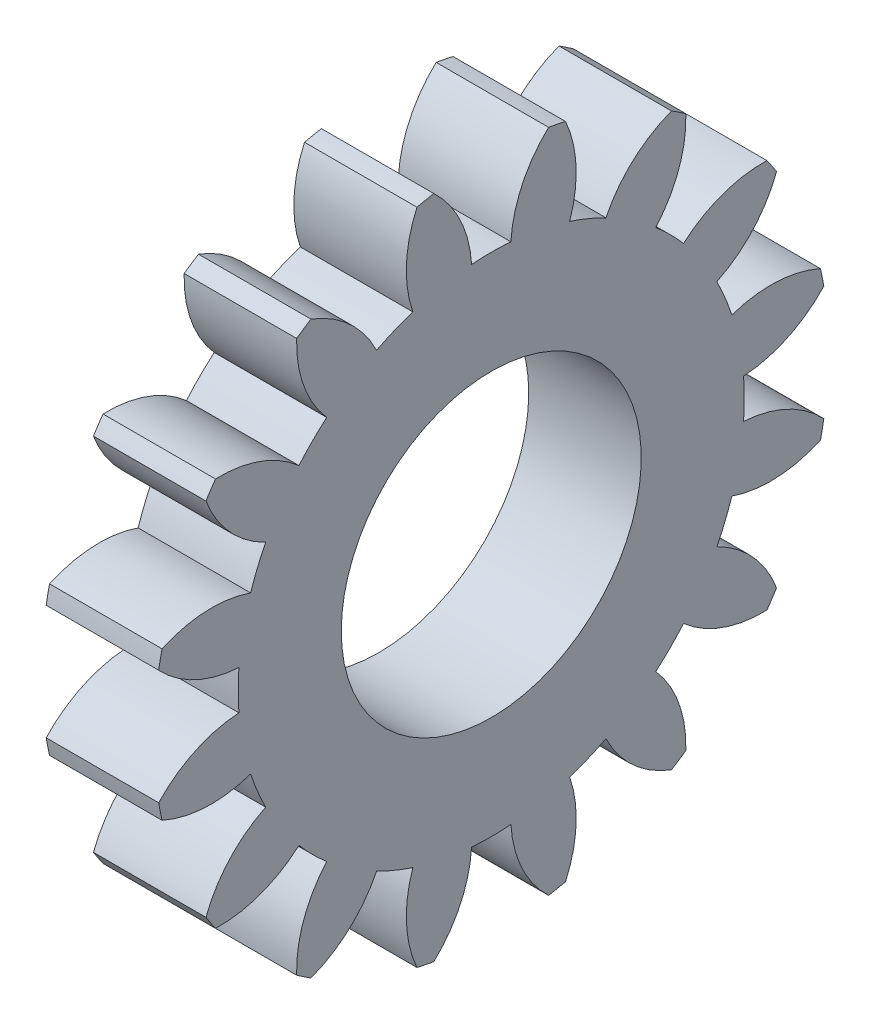
from build123d import *

# Parameters (mm, degrees)
BASPROSKE_W     = 3
BASPROSKE_H     = 9
TOOTHCUT_DEPTH  = 14.076696831
TEETHCUTS_COUNT = 16
TEETHCUTS_ANGLE = 337.5
BORSKE_R        = 4
BORE_DEPTH      = 50.0000508


with BuildPart() as part:
    # BasProSke → Base-Revolve (revolve)
    with BuildSketch(Plane(origin=(0, 0, 0), x_dir=(1, 0, 0), z_dir=(0, 1, 0)), mode=Mode.PRIVATE) as base_revolve_sk:
        with Locations((1.5, 4.5)):
            Rectangle(BASPROSKE_W, BASPROSKE_H)
    revolve(base_revolve_sk.sketch.rotate(Axis((-10, 0, 0), (1, 0, 0)), 180), axis=Axis((-10, 0, 0), (1, 0, 0)))

    # TooCutSke → ToothCut (cut, through all)
    with BuildSketch(Plane(origin=(0, 0, 0), x_dir=(0, 0, -1), z_dir=(1, 0, 0))):
        with BuildLine():
            ThreePointArc((0.523792937, 6.728643397), (0, 6.749), (-0.523792937, 6.728643397))
            ThreePointArc((-0.523792937, 6.728643397), (-0.828704482, 7.90962059), (-1.553355277, 8.890721711))
            ThreePointArc((-1.553355277, 8.890721711), (0, 9.0254), (1.553355277, 8.890721711))
            ThreePointArc((1.553355277, 8.890721711), (0.828704482, 7.90962059), (0.523792937, 6.728643397))
        make_face()
    toothcut = extrude(amount=TOOTHCUT_DEPTH, mode=Mode.SUBTRACT)

    # TeethCuts: ToothCut ×16 about axis
    teethcuts_axis = Axis((-10, 0, 0), (1, 0, 0))
    for i in range(1, TEETHCUTS_COUNT):
        add(toothcut.rotate(teethcuts_axis, i * TEETHCUTS_ANGLE / (TEETHCUTS_COUNT - 1)), mode=Mode.SUBTRACT)

    # BorSke → Bore (cut, symmetric)
    with BuildSketch(Plane(origin=(0, 0, 0), x_dir=(0, 0, -1), z_dir=(1, 0, 0))):
        with Locations(Location((0, 0, 0), (0, 0, 180))):
            Circle(BORSKE_R)
    extrude(amount=BORE_DEPTH, both=True, mode=Mode.SUBTRACT)


solid = part.part
